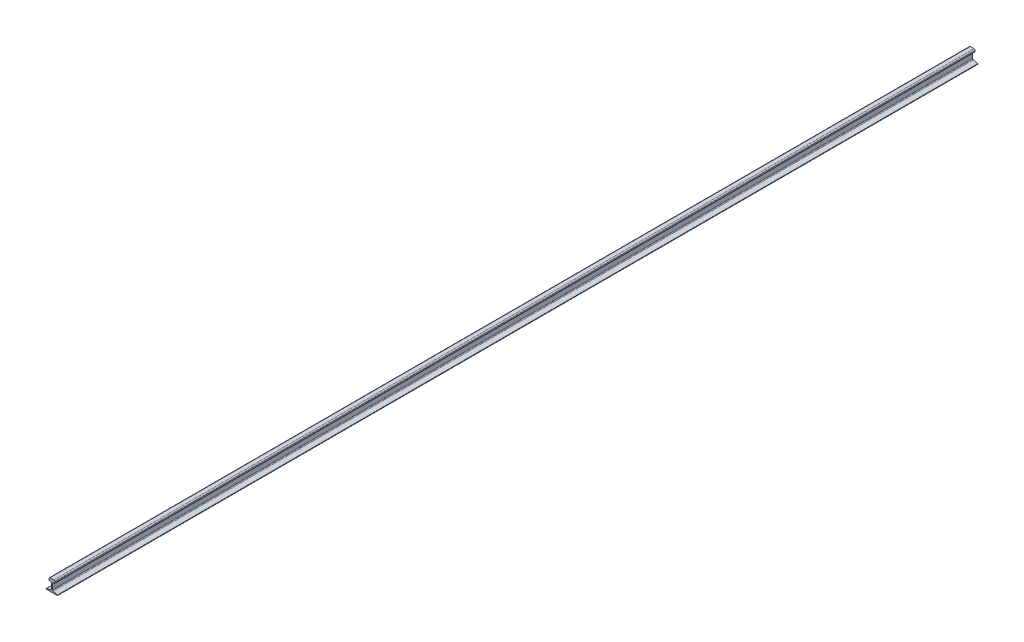
from build123d import *

# Parameters (mm, degrees)
EXTRUDE_1_DEPTH = 2500


with BuildPart() as part:
    # 草图1 → 拉伸1 (new, symmetric)
    with BuildSketch(Plane.XY):
        with BuildLine():
            Line((-9.7, 31.75), (9.7, 31.75))
            ThreePointArc((9.7, 31.75), (14.190128061, 29.890128061), (16.05, 25.4))
            Line((16.05, 25.4), (16.05, 19.85334238))
            ThreePointArc((16.05, 19.85334238), (15.704346969, 18.863544107), (14.817672176, 18.304093977))
            Line((14.817672176, 18.304093977), (6.639232981, 16.415952513))
            ThreePointArc((6.639232981, 16.415952513), (3.984785173, 14.741120675), (2.95, 11.777951005))
            Line((2.95, 11.777951005), (2.95, -18.3447862))
            ThreePointArc((2.95, -18.3447862), (3.984785173, -21.307955871), (6.639232981, -22.982787709))
            Line((6.639232981, -22.982787709), (30.517672176, -28.495559773))
            ThreePointArc((30.517672176, -28.495559773), (31.404346969, -29.055009903), (31.75, -30.044808176))
            Line((31.75, -30.044808176), (31.75, -30.16))
            ThreePointArc((31.75, -30.16), (31.284299782, -31.284299782), (30.16, -31.75))
            Line((30.16, -31.75), (-30.16, -31.75))
            ThreePointArc((-30.16, -31.75), (-31.284299782, -31.284299782), (-31.75, -30.16))
            Line((-31.75, -30.16), (-31.75, -30.044808176))
            ThreePointArc((-31.75, -30.044808176), (-31.404346969, -29.055009903), (-30.517672176, -28.495559773))
            Line((-30.517672176, -28.495559773), (-6.639232981, -22.982787709))
            ThreePointArc((-6.639232981, -22.982787709), (-3.984785173, -21.307955871), (-2.95, -18.3447862))
            Line((-2.95, -18.3447862), (-2.95, 11.777951005))
            ThreePointArc((-2.95, 11.777951005), (-3.984785173, 14.741120675), (-6.639232981, 16.415952513))
            Line((-6.639232981, 16.415952513), (-14.817672176, 18.304093977))
            ThreePointArc((-14.817672176, 18.304093977), (-15.704346969, 18.863544107), (-16.05, 19.85334238))
            Line((-16.05, 19.85334238), (-16.05, 25.4))
            ThreePointArc((-16.05, 25.4), (-14.190128061, 29.890128061), (-9.7, 31.75))
        make_face()
    extrude(amount=EXTRUDE_1_DEPTH, both=True)


solid = part.part
